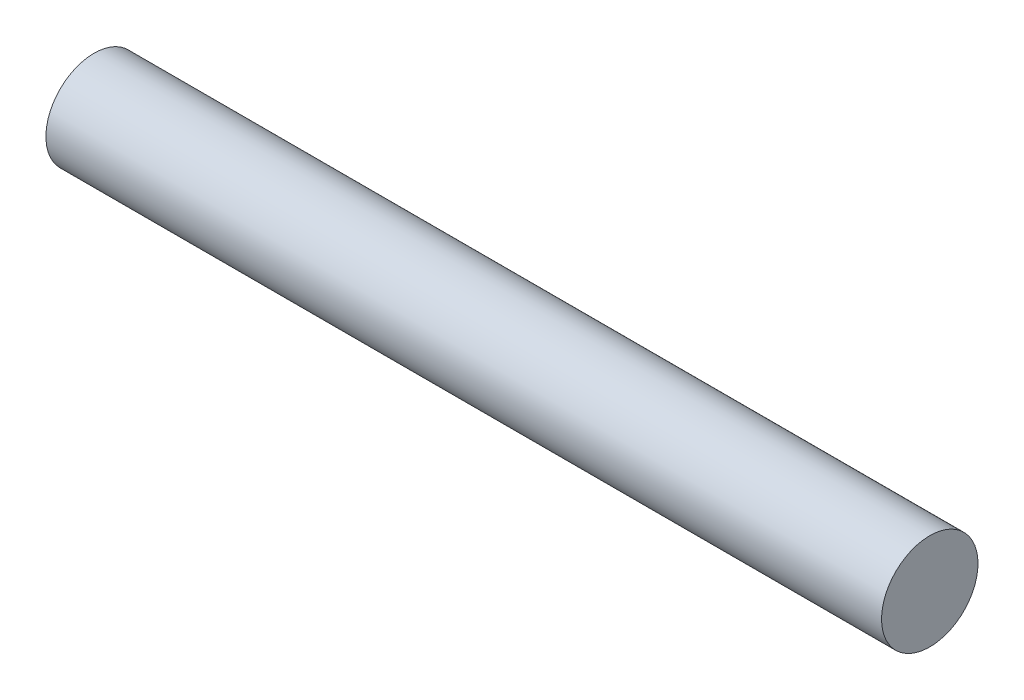
from build123d import *

# Parameters (mm, degrees)
SKETCH2_R          = 3.75
BASE_EXTRUDE_DEPTH = 65


with BuildPart() as part:
    # Sketch2 → Base-Extrude (new body)
    with BuildSketch(Plane(origin=(0, 0, 0), x_dir=(0, 0, -1), z_dir=(1, 0, 0))):
        Circle(SKETCH2_R)
    extrude(amount=BASE_EXTRUDE_DEPTH)


solid = part.part
